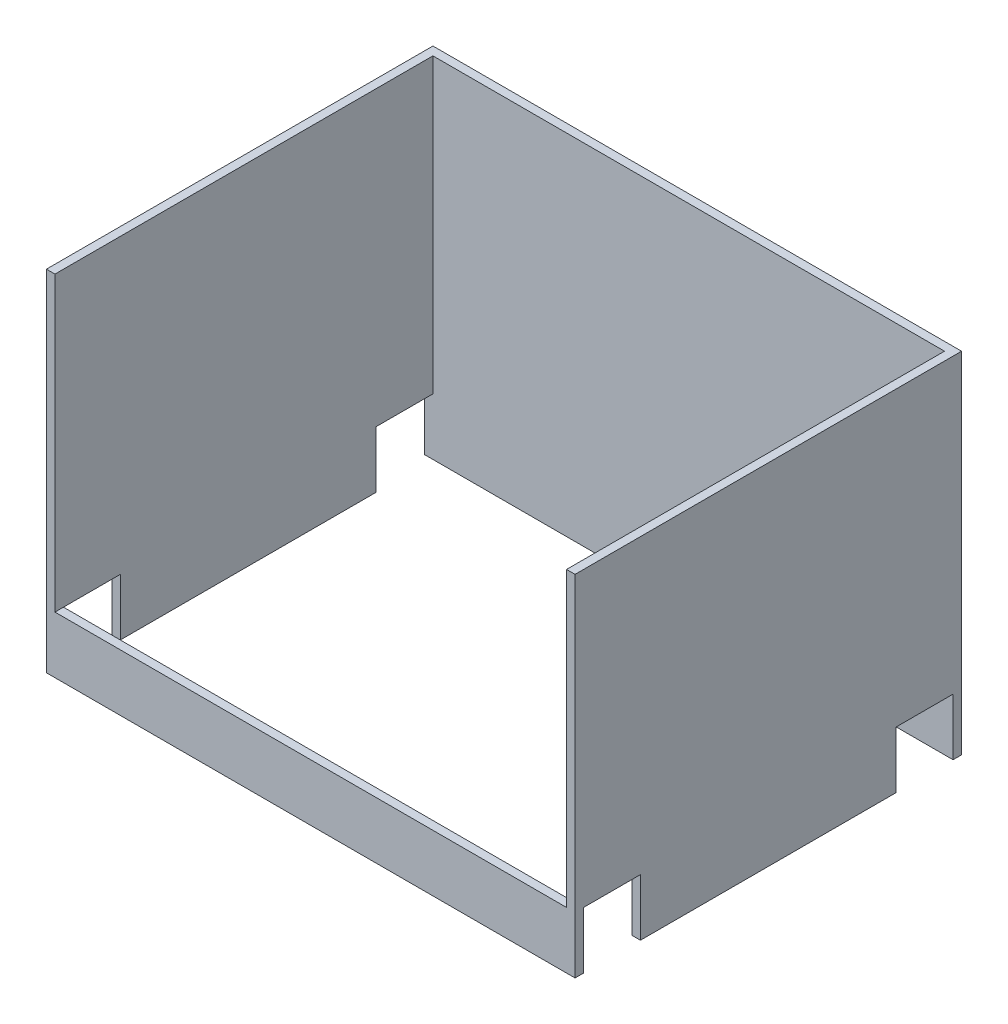
from build123d import *

# Parameters (mm, degrees)
SKETCH2_W               = 186
SKETCH2_H               = 136
BOSS_EXTRUDE1_DEPTH     = 20
BOSS_EXTRUDE2_DEPTH     = 103
CUT_EXTRUDE1_DEPTH      = 224.224102641
CUT_EXTRUDE1_DEPTH_BACK = 224.224102641
SKETCH4_W               = 20
SKETCH4_H               = 20


with BuildPart() as part:
    # Sketch2 → Boss-Extrude1 (new body)
    with BuildSketch(Plane(origin=(0, 0, 0), x_dir=(1, 0, 0), z_dir=(0, 1, 0))):
        Rectangle(SKETCH2_W, SKETCH2_H)
        Polygon((-90, -65), (-90, -60), (-90, 60), (-90, 65), (90, 65), (90, 60), (90, -60), (90, -65), align=None, mode=Mode.SUBTRACT)
    extrude(amount=-BOSS_EXTRUDE1_DEPTH)

    # Sketch3 → Boss-Extrude2 (add)
    with BuildSketch(Plane(origin=(0, 0, 0), x_dir=(1, 0, 0), z_dir=(0, 1, 0))):
        Polygon((-93, 65), (-93, -68), (-90, -68), (-90, -65), (-90, 65), align=None)
        Polygon((-93, 68), (-93, 65), (-90, 65), (90, 65), (93, 65), (93, 68), align=None)
        Polygon((90, -65), (90, -68), (93, -68), (93, 65), (90, 65), align=None)
    extrude(amount=BOSS_EXTRUDE2_DEPTH)

    # Sketch4 → Cut-Extrude1 (cut, two sides: drawn at the far end of the back side and taken through both)
    with BuildSketch(Plane(origin=(93, 0, 0), x_dir=(0, 0, -1), z_dir=(1, 0, 0)).offset(-CUT_EXTRUDE1_DEPTH_BACK)):
        with Locations((-55, -10)):
            Rectangle(SKETCH4_W, SKETCH4_H)
        with Locations((55, -10)):
            Rectangle(SKETCH4_W, SKETCH4_H)
    extrude(amount=CUT_EXTRUDE1_DEPTH + CUT_EXTRUDE1_DEPTH_BACK, mode=Mode.SUBTRACT)


solid = part.part
